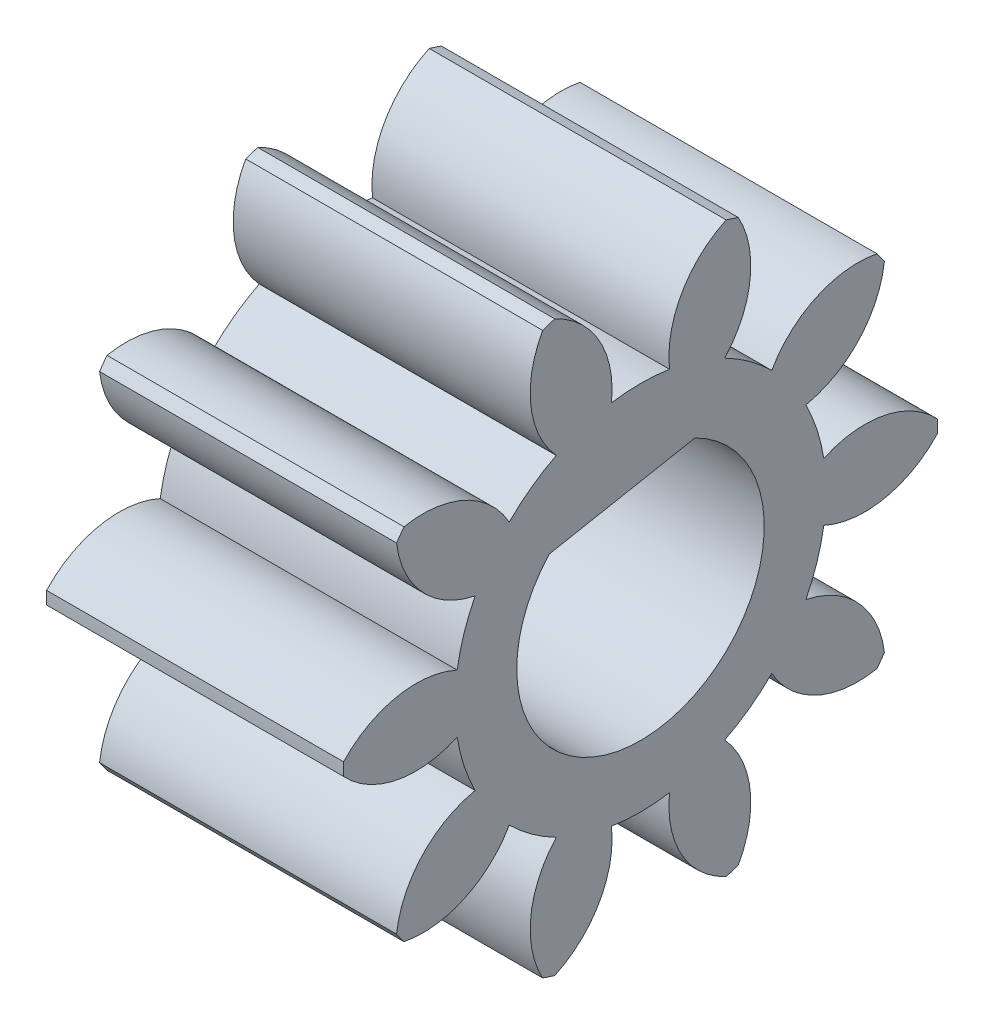
from build123d import *

# Parameters (mm, degrees)
BASPROSKE_W        = 12
BASPROSKE_H        = 12
TOOTHCUT_DEPTH     = 21.784609691
TEETHCUTS_COUNT    = 10
TEETHCUTS_ANGLE    = 324
BORSKE_R           = 0.4
BORE_DEPTH         = 50.0000508
SCALE1_SCALE       = 0.5
CUT_EXTRUDE1_DEPTH = 11.2470399


with BuildPart() as part:
    # BasProSke → Base-Revolve (revolve)
    with BuildSketch(Plane(origin=(0, 0, 0), x_dir=(1, 0, 0), z_dir=(0, 1, 0)), mode=Mode.PRIVATE) as base_revolve_sk:
        with Locations((6, 6)):
            Rectangle(BASPROSKE_W, BASPROSKE_H)
    revolve(base_revolve_sk.sketch.rotate(Axis((-10, 0, 0), (1, 0, 0)), 180), axis=Axis((-10, 0, 0), (1, 0, 0)))

    # TooCutSke → ToothCut (cut, through all)
    with BuildSketch(Plane(origin=(0, 0, 0), x_dir=(0, 0, -1), z_dir=(1, 0, 0))):
        with BuildLine():
            ThreePointArc((1.173662691, 7.406586048), (0, 7.499), (-1.173662691, 7.406586048))
            ThreePointArc((-1.173662691, 7.406586048), (-1.668191438, 9.834565786), (-3.497907776, 11.50542856))
            ThreePointArc((-3.497907776, 11.50542856), (0, 12.0254), (3.497907776, 11.50542856))
            ThreePointArc((3.497907776, 11.50542856), (1.668191438, 9.834565786), (1.173662691, 7.406586048))
        make_face()
    toothcut = extrude(amount=TOOTHCUT_DEPTH, mode=Mode.SUBTRACT)

    # TeethCuts: ToothCut ×10 about axis
    teethcuts_axis = Axis((-10, 0, 0), (1, 0, 0))
    for i in range(1, TEETHCUTS_COUNT):
        add(toothcut.rotate(teethcuts_axis, i * TEETHCUTS_ANGLE / (TEETHCUTS_COUNT - 1)), mode=Mode.SUBTRACT)

    # BorSke → Bore (cut, symmetric)
    with BuildSketch(Plane(origin=(0, 0, 0), x_dir=(0, 0, -1), z_dir=(1, 0, 0))):
        with Locations(Location((0, 0, 0), (0, 0, 180))):
            Circle(BORSKE_R)
    extrude(amount=BORE_DEPTH, both=True, mode=Mode.SUBTRACT)


with BuildPart() as part_1:
    # Scale1: scaled about (6, 0, 0)
    add(part.part.scale(SCALE1_SCALE).moved(Location((3, 0, 0))))

    # Sketch2 → Cut-Extrude1 (cut, through all)
    with BuildSketch(Plane(origin=(9, 0, 0), x_dir=(0, 0, -1), z_dir=(1, 0, 0))):
        with BuildLine():
            Line((-1.84770017, 1.684043967), (1.09932616, 2.245324474))
            ThreePointArc((1.09932616, 2.245324474), (0.467733756, -2.455855275), (-1.84770017, 1.684043967))
        make_face()
    extrude(amount=-CUT_EXTRUDE1_DEPTH, mode=Mode.SUBTRACT)


solid = part_1.part
